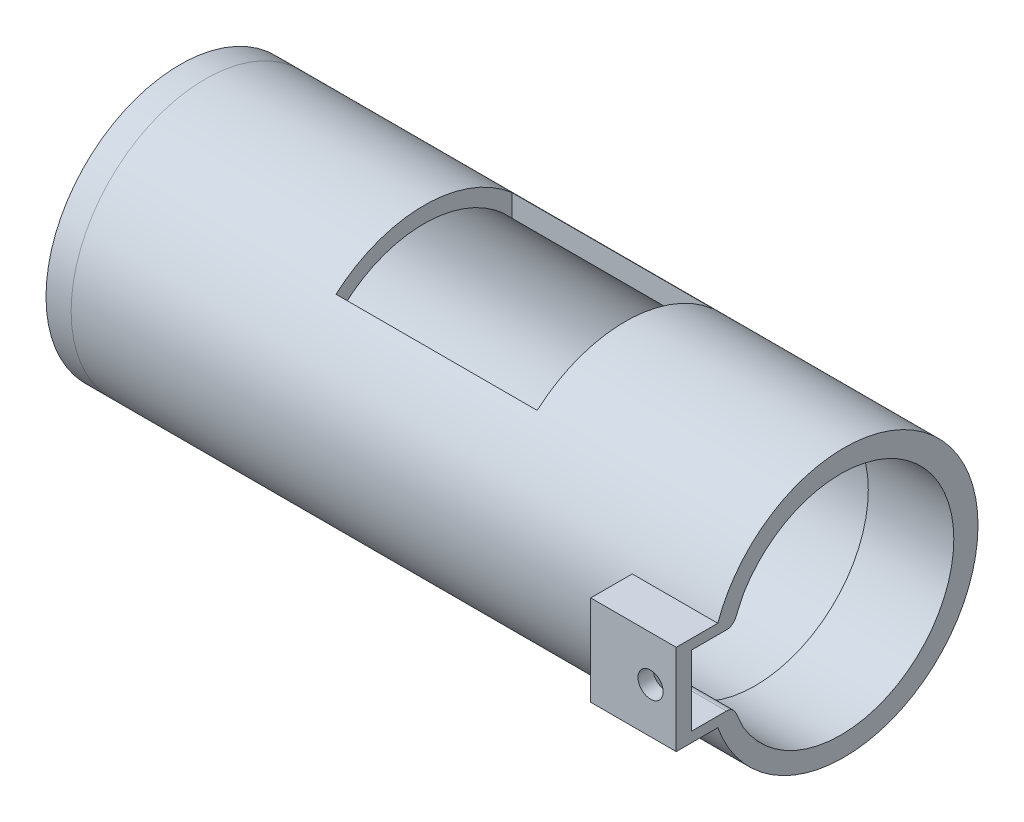
from build123d import *

# Parameters (mm, degrees)
BOSS_EXTRUDE4_DEPTH     = 10.2
CUT_EXTRUDE2_START      = 65.835033
SKETCH6_R               = 2.5
CUT_EXTRUDE2_DEPTH      = 3
BOSS_EXTRUDE2_START     = -10.2
BOSS_EXTRUDE2_DEPTH     = 6.8
BOSS_EXTRUDE3_START     = -17
SKETCH9_R               = 26.65
SKETCH9_R_2             = 23.5
BOSS_EXTRUDE3_DEPTH     = 110
BOSS_EXTRUDE5_START     = -127
SKETCH9_2_R             = 26.65
SKETCH9_2_R_2           = 23.5
BOSS_EXTRUDE5_DEPTH     = 5
CUT_EXTRUDE3_DEPTH      = 153.745152921
CUT_EXTRUDE3_DEPTH_BACK = 153.745152921
SKETCH11_W              = 40
SKETCH11_H              = 35


with BuildPart() as part:
    # Sketch2 → Boss-Extrude4 (new body)
    with BuildSketch(Plane(origin=(0, 0, 0), x_dir=(0, 0, -1), z_dir=(1, 0, 0))):
        with BuildLine():
            Line((-65.835032972, 21.993922963), (-65.835032972, 4.023922963))
            Line((-65.835032972, 4.023922963), (-57.574717605, 4.023922963))
            ThreePointArc((-57.574717605, 4.023922963), (-5.835032972, 13.008922963), (-57.574717605, 21.993922963))
            Line((-57.574717605, 21.993922963), (-65.835032972, 21.993922963))
        make_face()
        with BuildLine():
            Line((-62.835032972, 19.993922963), (-62.835032972, 6.023922963))
            Line((-62.835032972, 6.023922963), (-55.844102472, 6.023922963))
            ThreePointArc((-55.844102472, 6.023922963), (-54.765274922, 5.708004647), (-54.027268755, 4.860054081))
            Line((-54.027268755, 4.860054081), (-52.485033553, 1.508923075))
            ThreePointArc((-52.485033553, 1.508923075), (-10.645953881, 13.008922963), (-52.485033553, 24.508922852))
            Line((-52.485033553, 24.508922852), (-54.027268755, 21.157791846))
            ThreePointArc((-54.027268755, 21.157791846), (-54.765274922, 20.30984128), (-55.844102472, 19.993922963))
            Line((-55.844102472, 19.993922963), (-62.835032972, 19.993922963))
        make_face(mode=Mode.SUBTRACT)
    extrude(amount=-BOSS_EXTRUDE4_DEPTH)

    # Sketch6 → Cut-Extrude2 (cut)
    with BuildSketch(Plane.XY.offset(CUT_EXTRUDE2_START)):
        with Locations((-5.1, 13.008922963)):
            Circle(SKETCH6_R)
    extrude(amount=-CUT_EXTRUDE2_DEPTH, mode=Mode.SUBTRACT)

    # Sketch8 → Boss-Extrude2 (add)
    with BuildSketch(Plane(origin=(0, 0, 0), x_dir=(0, 0, -1), z_dir=(1, 0, 0)).offset(BOSS_EXTRUDE2_START)):
        with BuildLine():
            Line((-57.574717605, 21.993922963), (-65.835032972, 21.993922963))
            Line((-65.835032972, 21.993922963), (-65.835032972, 4.023922963))
            Line((-65.835032972, 4.023922963), (-57.574717605, 4.023922963))
            ThreePointArc((-57.574717605, 4.023922963), (-5.835032972, 13.008922963), (-57.574717605, 21.993922963))
        make_face()
        with BuildLine():
            Line((-54.027268755, 4.860054081), (-52.485033553, 1.508923075))
            ThreePointArc((-52.485033553, 1.508923075), (-10.645953881, 13.008922963), (-52.485033553, 24.508922852))
            Line((-52.485033553, 24.508922852), (-54.027268755, 21.157791846))
            ThreePointArc((-54.027268755, 21.157791846), (-55.812393115, 13.008922963), (-54.027268755, 4.860054081))
        make_face(mode=Mode.SUBTRACT)
    extrude(amount=-BOSS_EXTRUDE2_DEPTH)

    # Sketch9 → Boss-Extrude3 (add)
    with BuildSketch(Plane(origin=(0, 0, 0), x_dir=(0, 0, -1), z_dir=(1, 0, 0)).offset(BOSS_EXTRUDE3_START)):
        with Locations((-32.485032972, 13.008922963)):
            Circle(SKETCH9_R)
        with Locations((-32.485032972, 13.008922963)):
            Circle(SKETCH9_R_2, mode=Mode.SUBTRACT)
    extrude(amount=-BOSS_EXTRUDE3_DEPTH)

    # Sketch11 → Cut-Extrude3 (cut, two sides: drawn at the far end of the back side and taken through both)
    with BuildSketch(Plane(origin=(0, 0, 0), x_dir=(1, 0, 0), z_dir=(0, 1, 0)).offset(-CUT_EXTRUDE3_DEPTH_BACK)):
        with Locations((-63.5, -32.485032972)):
            Rectangle(SKETCH11_W, SKETCH11_H)
    extrude(amount=CUT_EXTRUDE3_DEPTH + CUT_EXTRUDE3_DEPTH_BACK, mode=Mode.SUBTRACT)


with BuildPart() as body_2:
    # Sketch9<2> → Boss-Extrude5 (new body)
    with BuildSketch(Plane(origin=(0, 0, 0), x_dir=(0, 0, -1), z_dir=(1, 0, 0)).offset(BOSS_EXTRUDE5_START)):
        with Locations((-32.485032972, 13.008922963)):
            Circle(SKETCH9_2_R)
        with Locations((-32.485032972, 13.008922963)):
            Circle(SKETCH9_2_R_2, mode=Mode.SUBTRACT)
    extrude(amount=-BOSS_EXTRUDE5_DEPTH)


solid = Compound([part.part, body_2.part])
